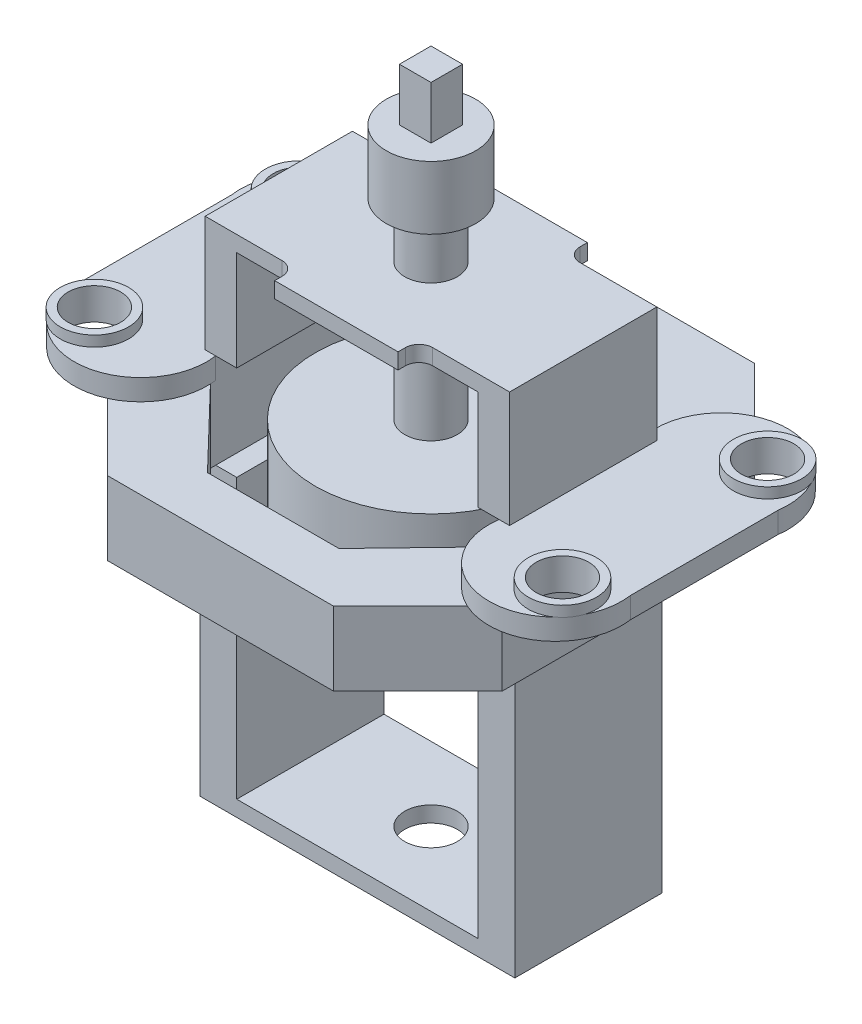
from build123d import *

# Parameters (mm, degrees)
SALIENTE_EXTRUIR1_DEPTH  = 14
CROQUIS4_R               = 22
SALIENTE_EXTRUIR2_DEPTH  = 15
CROQUIS5_R               = 5
SALIENTE_EXTRUIR3_DEPTH  = 4
CROQUIS7_R               = 6.5
CROQUIS7_R_2             = 5
SALIENTE_EXTRUIR4_DEPTH  = 2
SALIENTE_EXTRUIR5_DEPTH  = 19
CROQUIS9_R               = 5
SALIENTE_EXTRUIR6_DEPTH  = 3
CROQUIS10_R              = 5
SALIENTE_EXTRUIR7_DEPTH  = 36.5
CROQUIS12_R              = 8.5
SALIENTE_EXTRUIR8_DEPTH  = 12
SALIENTE_EXTRUIR9_DEPTH  = 53
SALIENTE_EXTRUIR10_START = 3
CROQUIS14_W              = 59.880061862
CROQUIS14_H              = 28
CROQUIS14_R              = 5
SALIENTE_EXTRUIR10_DEPTH = 3
SALIENTE_EXTRUIR11_DEPTH = 10


with BuildPart() as part:
    # Croquis2 → Saliente-Extruir1 (new body)
    with BuildSketch(Plane(origin=(0, 0, 0), x_dir=(1, 0, 0), z_dir=(0, 1, 0))):
        Polygon((43, 0), (0, 0), (-16, -16), (-16, -64), (0, -80), (21.5, -80), (43, -80), (59, -64), (59, -16), align=None)
        Polygon((48.440030931, -25), (48.440030931, -55), (34, -70), (9, -70), (-5.440030931, -55), (-5.440030931, -25), (9, -10), (34, -10), align=None, mode=Mode.SUBTRACT)
    extrude(amount=SALIENTE_EXTRUIR1_DEPTH)

    # Croquis5 → Saliente-Extruir3 (add)
    # profile 1 of 2: a face of its own
    with BuildSketch(Plane(origin=(0, 14, 0), x_dir=(1, 0, 0), z_dir=(0, 1, 0))):
        with BuildLine():
            Line((-30.440030931, -26), (-30.440030931, -54))
            ThreePointArc((-30.440030931, -54), (-17.940030931, -68.416978851), (-5.440030931, -54))
            Line((-5.440030931, -54), (-5.440030931, -26))
            ThreePointArc((-5.440030931, -26), (-17.940030931, -11.583021149), (-30.440030931, -26))
        make_face()
        with Locations(Location((-23, -59.5, 0), (0, 0, 270))):
            Circle(CROQUIS5_R, mode=Mode.SUBTRACT)
        with Locations(Location((-23, -20.5, 0), (0, 0, 90))):
            Circle(CROQUIS5_R, mode=Mode.SUBTRACT)
    # profile 2 of 2: a face of its own
    with BuildSketch(Plane(origin=(0, 14, 0), x_dir=(1, 0, 0), z_dir=(0, 1, 0))):
        with BuildLine():
            Line((48.440030931, -26), (48.440030931, -54))
            ThreePointArc((48.440030931, -54), (60.940030931, -68.416978851), (73.440030931, -54))
            Line((73.440030931, -54), (73.440030931, -26))
            ThreePointArc((73.440030931, -26), (60.940030931, -11.583021149), (48.440030931, -26))
        make_face()
        with Locations(Location((66, -20.5, 0), (0, 0, 270))):
            Circle(CROQUIS5_R, mode=Mode.SUBTRACT)
        with Locations(Location((66, -59.5, 0), (0, 0, 90))):
            Circle(CROQUIS5_R, mode=Mode.SUBTRACT)
    extrude(amount=SALIENTE_EXTRUIR3_DEPTH)

    # Croquis7 → Saliente-Extruir4 (add)
    # profile 1 of 4: a face of its own
    with BuildSketch(Plane(origin=(0, 18, 0), x_dir=(1, 0, 0), z_dir=(0, 1, 0))):
        with Locations(Location((-23, -20.5, 0), (0, 0, 126.333634549))):
            Circle(CROQUIS7_R)
        with Locations(Location((-23, -20.5, 0), (0, 0, 90))):
            Circle(CROQUIS7_R_2, mode=Mode.SUBTRACT)
    # profile 2 of 4: a face of its own
    with BuildSketch(Plane(origin=(0, 18, 0), x_dir=(1, 0, 0), z_dir=(0, 1, 0))):
        with Locations(Location((-23, -59.5, 0), (0, 0, 90))):
            Circle(CROQUIS7_R)
        with Locations(Location((-23, -59.5, 0), (0, 0, 90))):
            Circle(CROQUIS7_R_2, mode=Mode.SUBTRACT)
    # profile 3 of 4: a face of its own
    with BuildSketch(Plane(origin=(0, 18, 0), x_dir=(1, 0, 0), z_dir=(0, 1, 0))):
        with Locations(Location((66, -59.5, 0), (0, 0, 341.1612762))):
            Circle(CROQUIS7_R)
        with Locations(Location((66, -59.5, 0), (0, 0, 90))):
            Circle(CROQUIS7_R_2, mode=Mode.SUBTRACT)
    # profile 4 of 4: a face of its own
    with BuildSketch(Plane(origin=(0, 18, 0), x_dir=(1, 0, 0), z_dir=(0, 1, 0))):
        with Locations(Location((66, -20.5, 0), (0, 0, 90))):
            Circle(CROQUIS7_R)
        with Locations(Location((66, -20.5, 0), (0, 0, 90))):
            Circle(CROQUIS7_R_2, mode=Mode.SUBTRACT)
    extrude(amount=SALIENTE_EXTRUIR4_DEPTH)

    # Croquis8 → Saliente-Extruir5 (add)
    with BuildSketch(Plane(origin=(0, 18, 0), x_dir=(1, 0, 0), z_dir=(0, 1, 0))):
        Polygon((-5.440030931, -26), (-1.440030931, -26), (-1.440030931, -54), (-5.440030931, -54), (-7.440030931, -54), (-7.440030931, -26), align=None)
        Polygon((50.440030931, -54), (48.440030931, -54), (44.440030931, -54), (44.440030931, -26), (48.440030931, -26), (50.440030931, -26), align=None)
    extrude(amount=SALIENTE_EXTRUIR5_DEPTH)

    # Croquis9 → Saliente-Extruir6 (add)
    with BuildSketch(Plane(origin=(0, 37, 0), x_dir=(1, 0, 0), z_dir=(0, 1, 0))):
        with BuildLine():
            Line((-7.440030931, -26), (7.17351898, -26))
            ThreePointArc((7.17351898, -26), (9.011002532, -25.238889392), (9.77211314, -23.40140584))
            Line((9.77211314, -23.40140584), (9.77211314, -22.000951417))
            Line((9.77211314, -22.000951417), (33.22788686, -22.000951417))
            Line((33.22788686, -22.000951417), (33.22788686, -23.40140584))
            ThreePointArc((33.22788686, -23.40140584), (33.988997468, -25.238889392), (35.82648102, -26))
            Line((35.82648102, -26), (50.440030931, -26))
            Line((50.440030931, -26), (50.440030931, -54))
            Line((50.440030931, -54), (35.82648102, -54))
            ThreePointArc((35.82648102, -54), (33.988997468, -54.761110608), (33.22788686, -56.59859416))
            Line((33.22788686, -56.59859416), (33.22788686, -57.999048583))
            Line((33.22788686, -57.999048583), (9.77211314, -57.999048583))
            Line((9.77211314, -57.999048583), (9.77211314, -56.59859416))
            ThreePointArc((9.77211314, -56.59859416), (9.011002532, -54.761110608), (7.17351898, -54))
            Line((7.17351898, -54), (-7.440030931, -54))
            Line((-7.440030931, -54), (-7.440030931, -26))
        make_face()
        with Locations(Location((21.5, -40, 0), (0, 0, 270))):
            Circle(CROQUIS9_R, mode=Mode.SUBTRACT)
    extrude(amount=SALIENTE_EXTRUIR6_DEPTH)



with BuildPart() as body_2:
    # Croquis4 → Saliente-Extruir2 (new body)
    with BuildSketch(Plane(origin=(0, 14, 0), x_dir=(1, 0, 0), z_dir=(0, 1, 0))):
        with Locations(Location((21.5, -40, 0), (0, 0, 270))):
            Circle(CROQUIS4_R)
    extrude(amount=-SALIENTE_EXTRUIR2_DEPTH)


with BuildPart() as part_1:
    add(part.part)

    add(body_2.part)  # Saliente-Extruir7 merges body 2
    # Croquis10 → Saliente-Extruir7 (add)
    with BuildSketch(Plane(origin=(0, 14, 0), x_dir=(1, 0, 0), z_dir=(0, 1, 0))):
        with Locations(Location((21.5, -40, 0), (0, 0, 270))):
            Circle(CROQUIS10_R)
    extrude(amount=SALIENTE_EXTRUIR7_DEPTH)

    # Croquis12 → Saliente-Extruir8 (add)
    with BuildSketch(Plane(origin=(0, 50.5, 0), x_dir=(1, 0, 0), z_dir=(0, 1, 0))):
        with Locations(Location((21.5, -40, 0), (0, 0, 270))):
            Circle(CROQUIS12_R)
    extrude(amount=SALIENTE_EXTRUIR8_DEPTH)

    # Croquis13 → Saliente-Extruir9 (add)
    with BuildSketch(Plane.XZ):
        Polygon((-5.440030931, 54), (-1.440030931, 54), (-1.440030931, 26), (-5.440030931, 26), (-8.440030931, 26), (-8.440030931, 54), align=None)
        Polygon((48.440030931, 54), (51.440030931, 54), (51.440030931, 26), (44.440030931, 26), (44.440030931, 54), align=None)
    extrude(amount=SALIENTE_EXTRUIR9_DEPTH)

    # Croquis14 → Saliente-Extruir10 (add)
    with BuildSketch(Plane.XZ.offset(53).offset(SALIENTE_EXTRUIR10_START)):
        with Locations((21.5, 40)):
            Rectangle(CROQUIS14_W, CROQUIS14_H)
        with Locations(Location((21.5, 40, 0), (0, 0, 90))):
            Circle(CROQUIS14_R, mode=Mode.SUBTRACT)
    extrude(amount=-SALIENTE_EXTRUIR10_DEPTH)

    # Croquis15 → Saliente-Extruir11 (add)
    with BuildSketch(Plane(origin=(0, 62.5, 0), x_dir=(1, 0, 0), z_dir=(0, 1, 0))):
        Polygon((21.5, -37), (18.5, -37), (18.5, -43), (24.5, -43), (24.5, -37), align=None)
    extrude(amount=SALIENTE_EXTRUIR11_DEPTH)


solid = part_1.part
